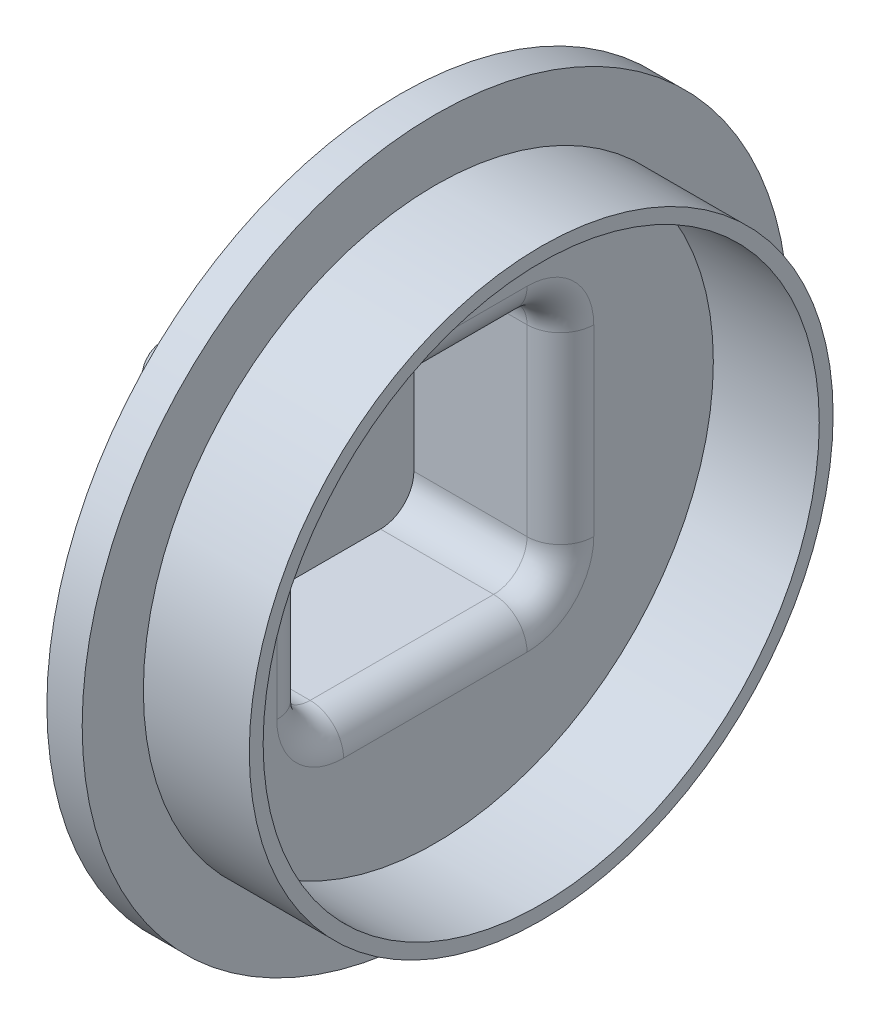
from build123d import *

# Parameters (mm, degrees)
SKETCH1_R           = 63.5
BOSS_EXTRUDE1_DEPTH = 6.35
SKETCH2_R           = 52.5
SKETCH2_R_2         = 50.00625
BOSS_EXTRUDE2_DEPTH = 19.05
SKETCH3_W           = 50
SKETCH3_H           = 50
BOSS_EXTRUDE3_DEPTH = 25
SKETCH4_W           = 45
SKETCH4_H           = 45
CUT_EXTRUDE1_DEPTH  = 26.35
FILLET1_R           = 6


with BuildPart() as part:
    # Sketch1 → Boss-Extrude1 (new body)
    with BuildSketch(Plane(origin=(0, 0, 0), x_dir=(0, 0, -1), z_dir=(1, 0, 0))):
        Circle(SKETCH1_R)
    extrude(amount=BOSS_EXTRUDE1_DEPTH)

    # Sketch2 → Boss-Extrude2 (add)
    with BuildSketch(Plane(origin=(6.35, 0, 0), x_dir=(0, 0, -1), z_dir=(1, 0, 0))):
        with Locations(Location((0, 0, 0), (0, 0, 180))):
            Circle(SKETCH2_R)
        with Locations(Location((0, 0, 0), (0, 0, 180))):
            Circle(SKETCH2_R_2, mode=Mode.SUBTRACT)
    extrude(amount=BOSS_EXTRUDE2_DEPTH)

    # Sketch3 → Boss-Extrude3 (add)
    with BuildSketch(Plane.ZY):
        Rectangle(SKETCH3_W, SKETCH3_H)
    extrude(amount=BOSS_EXTRUDE3_DEPTH)

    # Sketch4 → Cut-Extrude1 (cut)
    with BuildSketch(Plane(origin=(6.35, 0, 0), x_dir=(0, 0, -1), z_dir=(1, 0, 0))):
        Rectangle(SKETCH4_W, SKETCH4_H)
    extrude(amount=-CUT_EXTRUDE1_DEPTH, mode=Mode.SUBTRACT)

    # Fillet1
    fillet1_edges = [part.edges().sort_by_distance(p)[0] for p in [
        (-12.5, -25, 25),
        (-12.5, 25, 25),
        (-12.5, 25, -25),
        (-12.5, -25, -25),
        (-25, 0, 25),
        (-25, 25, 0),
        (-25, 0, -25),
        (-25, -25, 0),
        (6.35, 0, -22.5),
        (6.35, 22.5, 0),
        (6.35, 0, 22.5),
        (6.35, -22.5, 0),
        (-6.825, 22.5, 22.5),
        (-6.825, -22.5, 22.5),
        (-6.825, -22.5, -22.5),
        (-6.825, 22.5, -22.5),
    ]]
    fillet(fillet1_edges, radius=FILLET1_R)


solid = part.part
